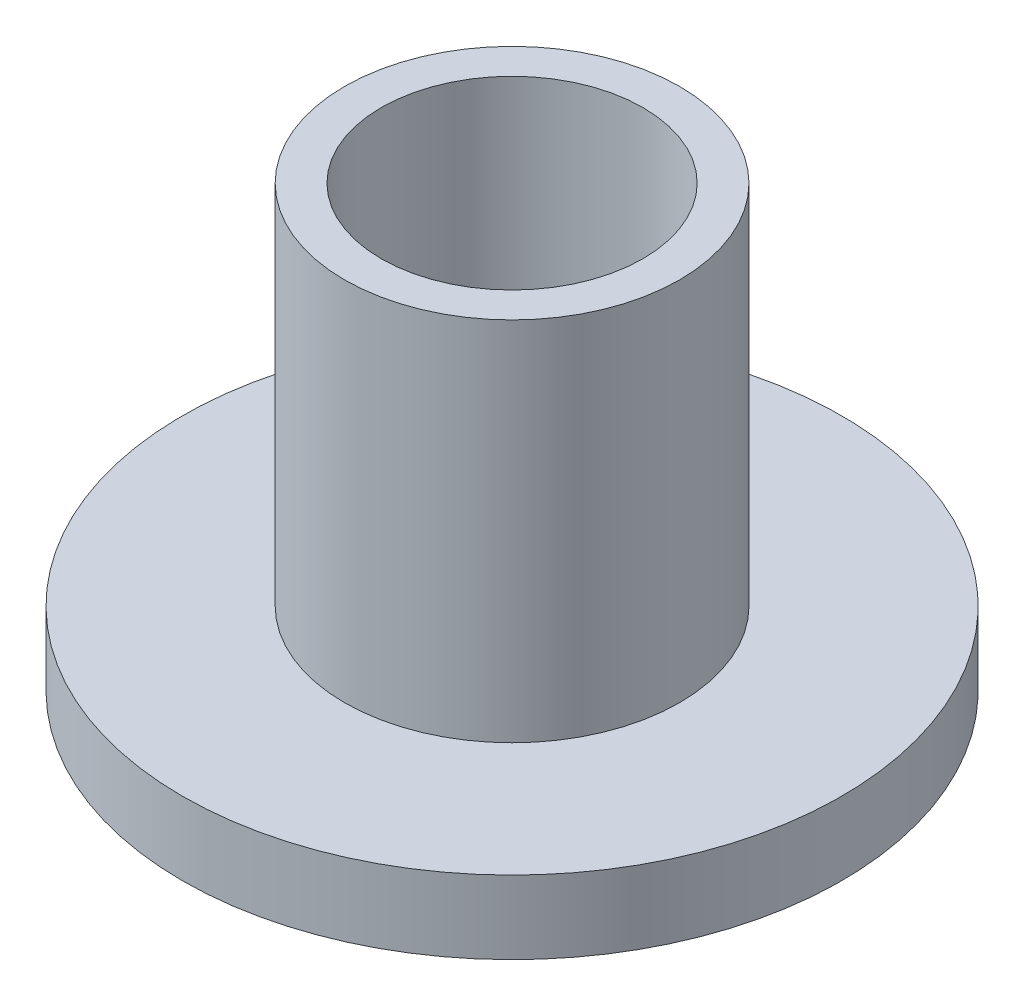
from build123d import *

# Parameters (mm, degrees)
SKETCH1_R           = 9
SKETCH1_R_2         = 3.575
BOSS_EXTRUDE1_DEPTH = 2
SKETCH2_R           = 4.575
SKETCH2_R_2         = 3.575
BOSS_EXTRUDE2_DEPTH = 10


with BuildPart() as part:
    # Sketch1 → Boss-Extrude1 (new body)
    with BuildSketch(Plane(origin=(0, 0, 0), x_dir=(1, 0, 0), z_dir=(0, 1, 0))):
        with Locations(Location((0, 0, 0), (0, 0, 270))):
            Circle(SKETCH1_R)
        with Locations(Location((0, 0, 0), (0, 0, 270))):
            Circle(SKETCH1_R_2, mode=Mode.SUBTRACT)
    extrude(amount=BOSS_EXTRUDE1_DEPTH)

    # Sketch2 → Boss-Extrude2 (add)
    with BuildSketch(Plane(origin=(0, 2, 0), x_dir=(1, 0, 0), z_dir=(0, 1, 0))):
        with Locations(Location((0, 0, 0), (0, 0, 270))):
            Circle(SKETCH2_R)
        with Locations(Location((0, 0, 0), (0, 0, 270))):
            Circle(SKETCH2_R_2, mode=Mode.SUBTRACT)
    extrude(amount=BOSS_EXTRUDE2_DEPTH)


solid = part.part
